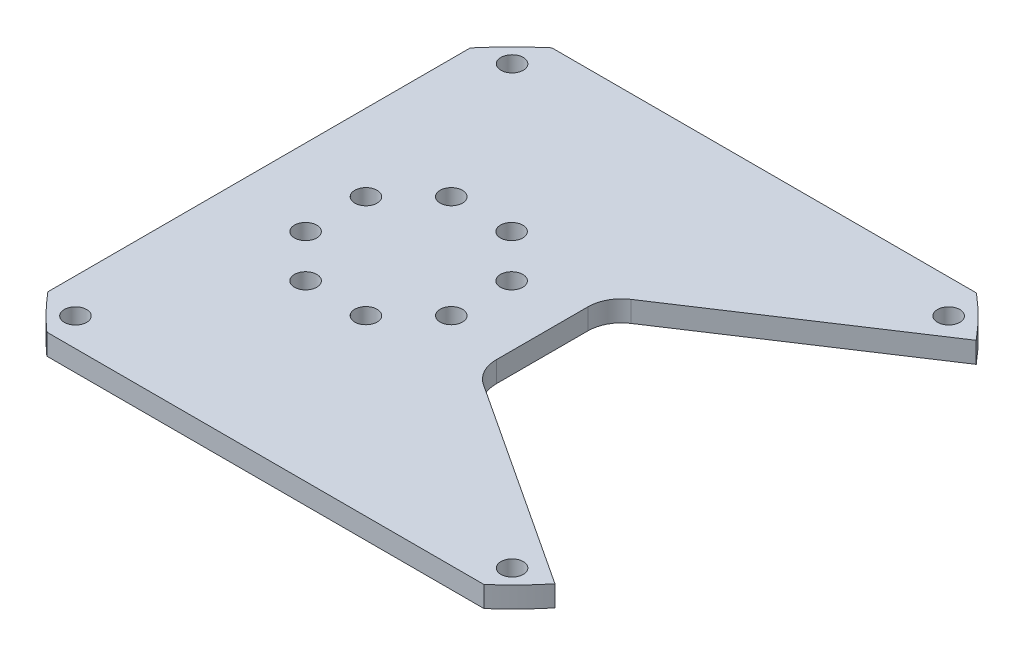
from build123d import *

# Parameters (mm, degrees)
BOSS_EXTRUDE1_DEPTH  = 1.5875
M3_CLEARANCE_HOLE1_D = 3.4
M3_CLEARANCE_HOLE2_D = 3.4
CIRPATTERN1_COUNT    = 8
FILLET1_R            = 5.08


with BuildPart() as part:
    # Sketch1 → Boss-Extrude1 (new, symmetric)
    with BuildSketch(Plane(origin=(0, 0, 0), x_dir=(1, 0, 0), z_dir=(0, 1, 0))):
        with BuildLine():
            Line((-38.50947489, 32.14883464), (-38.50947489, -32.14883464))
            ThreePointArc((-38.50947489, -32.14883464), (-35.992876625, -34.943383598), (-33.274, -37.541552299))
            Line((-33.274, -37.541552299), (33.274, -37.541552299))
            ThreePointArc((33.274, -37.541552299), (36.035191498, -34.899744966), (38.587271968, -32.055415565))
            Line((38.587271968, -32.055415565), (4.572, -9.720985565))
            Line((4.572, -9.720985565), (4.572, 9.720985565))
            Line((4.572, 9.720985565), (38.541369471, 32.110591154))
            ThreePointArc((38.541369471, 32.110591154), (35.567819018, 35.375944868), (32.318597457, 38.367114609))
            Line((32.318597457, 38.367114609), (-32.318597457, 38.367114609))
            ThreePointArc((-32.318597457, 38.367114609), (-35.55025611, 35.393594272), (-38.50947489, 32.14883464))
        make_face()
    extrude(amount=BOSS_EXTRUDE1_DEPTH, both=True)

    # M3 Clearance Hole1 (through all)
    with Locations(Plane(origin=(0, 1.5875, 0), x_dir=(1, 0, 0), z_dir=(0, 1, 0))):
        with Locations((-33.226947648, 33.226947648), (33.226947648, 33.226947648), (33.226947648, -33.226947648), (-33.226947648, -33.226947648)):
            Hole(M3_CLEARANCE_HOLE1_D / 2)

    # M3 Clearance Hole2 (through all)
    with Locations(Plane(origin=(0, -1.5875, 0), x_dir=(-1, 0, 0), z_dir=(0, -1, 0))):
        with Locations((4.66144561, -4.592201188)):
            m3_clearance_hole2 = Hole(M3_CLEARANCE_HOLE2_D / 2)

    # CirPattern1: M3 Clearance Hole2 ×8 about axis
    cirpattern1_axis = Axis((-15.748, 0, 0), (0, -1, 0))
    for i in range(1, CIRPATTERN1_COUNT):
        add(m3_clearance_hole2.rotate(cirpattern1_axis, i * 360 / CIRPATTERN1_COUNT), mode=Mode.SUBTRACT)

    # Fillet1
    fillet1_edges = [part.edges().sort_by_distance(p)[0] for p in [
        (4.572, 0, -9.720985565),
        (4.572, 0, 9.720985565),
    ]]
    fillet(fillet1_edges, radius=FILLET1_R)


solid = part.part
